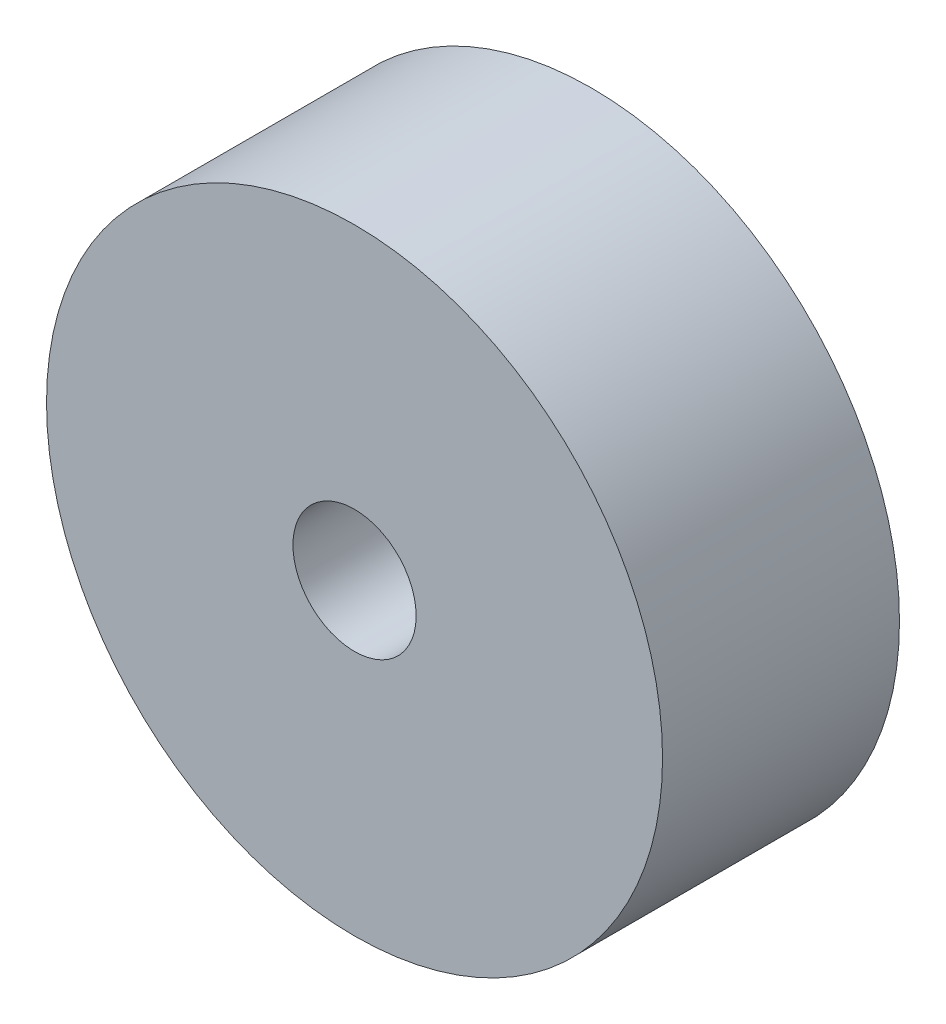
from build123d import *

# Parameters (mm, degrees)
SKETCH1_R           = 6.5
SKETCH1_R_2         = 1.3
BOSS_EXTRUDE5_DEPTH = 5


with BuildPart() as part:
    # Sketch1 → Boss-Extrude5 (new body)
    with BuildSketch(Plane.XY):
        Circle(SKETCH1_R)
        Circle(SKETCH1_R_2, mode=Mode.SUBTRACT)
    extrude(amount=BOSS_EXTRUDE5_DEPTH)


solid = part.part
